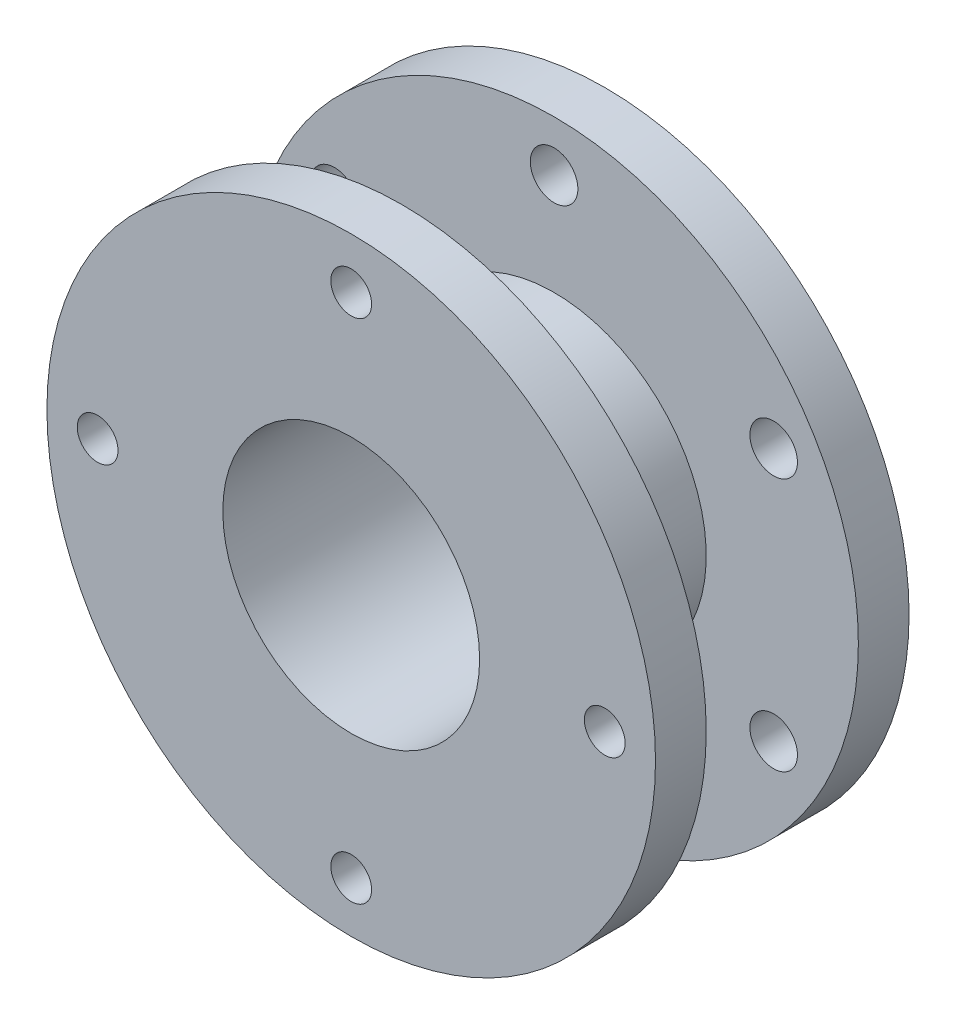
from build123d import *

# Parameters (mm, degrees)
SKETCH1_R                       = 38.1
BOSS_EXTRUDE1_DEPTH             = 6.35
SKETCH2_R                       = 19.05
BOSS_EXTRUDE2_DEPTH             = 19.05
SKETCH3_R                       = 16.0782
CUT_EXTRUDE1_DEPTH              = 60.56828015
CUT_EXTRUDE2_REACH              = 61.568
SKETCH4_R                       = 2.978668017
SKETCH5_R                       = 23.8633
SKETCH5_R_2                     = 21.7297
CUT_EXTRUDE3_DEPTH              = 1.3208
FILLET1_R                       = 0.127
FILLET2_R                       = 0.254
SKETCH6_R                       = 16.0782
CUT_EXTRUDE4_DEPTH              = 60.56828015
TAP_DRILL_FOR_1_4_20_TAP1_D     = 5.1054
TAP_DRILL_FOR_1_4_20_TAP1_DEPTH = 6.35


with BuildPart() as part:
    # Sketch1 → Boss-Extrude1 (new body)
    with BuildSketch(Plane.XY):
        Circle(SKETCH1_R)
    boss_extrude1 = extrude(amount=BOSS_EXTRUDE1_DEPTH)

    # Sketch2 → Boss-Extrude2 (add)
    with BuildSketch(Plane.XY.offset(6.35)):
        with Locations(Location((0, 0, 0), (0, 0, 180))):
            Circle(SKETCH2_R)
    extrude(amount=BOSS_EXTRUDE2_DEPTH)

    # Sketch3 → Cut-Extrude1 (cut, through all)
    with BuildSketch(Plane.XY.offset(25.4)):
        Circle(SKETCH3_R)
    extrude(amount=-CUT_EXTRUDE1_DEPTH, mode=Mode.SUBTRACT)

    # Sketch4 → Cut-Extrude2 (cut, up to next)
    with BuildSketch(Plane.XY, mode=Mode.PRIVATE) as cut_extrude2_sk1:
        with Locations(Location((0, 31.75, 0), (0, 0, 180))):
            Circle(SKETCH4_R)
    cut_extrude2_tool1 = extrude(cut_extrude2_sk1.sketch, amount=CUT_EXTRUDE2_REACH, mode=Mode.PRIVATE) & part.part
    # Sketch4 → Cut-Extrude2 (cut, up to next)
    with BuildSketch(Plane.XY, mode=Mode.PRIVATE) as cut_extrude2_sk2:
        with Locations(Location((27.49630657, 15.875, 0), (0, 0, 180))):
            Circle(SKETCH4_R)
    cut_extrude2_tool2 = extrude(cut_extrude2_sk2.sketch, amount=CUT_EXTRUDE2_REACH, mode=Mode.PRIVATE) & part.part
    # Sketch4 → Cut-Extrude2 (cut, up to next)
    with BuildSketch(Plane.XY, mode=Mode.PRIVATE) as cut_extrude2_sk3:
        with Locations(Location((27.49630657, -15.875, 0), (0, 0, 180))):
            Circle(SKETCH4_R)
    cut_extrude2_tool3 = extrude(cut_extrude2_sk3.sketch, amount=CUT_EXTRUDE2_REACH, mode=Mode.PRIVATE) & part.part
    # Sketch4 → Cut-Extrude2 (cut, up to next)
    with BuildSketch(Plane.XY, mode=Mode.PRIVATE) as cut_extrude2_sk4:
        with Locations(Location((0, -31.75, 0), (0, 0, 180))):
            Circle(SKETCH4_R)
    cut_extrude2_tool4 = extrude(cut_extrude2_sk4.sketch, amount=CUT_EXTRUDE2_REACH, mode=Mode.PRIVATE) & part.part
    # Sketch4 → Cut-Extrude2 (cut, up to next)
    with BuildSketch(Plane.XY, mode=Mode.PRIVATE) as cut_extrude2_sk5:
        with Locations(Location((-27.49630657, -15.875, 0), (0, 0, 180))):
            Circle(SKETCH4_R)
    cut_extrude2_tool5 = extrude(cut_extrude2_sk5.sketch, amount=CUT_EXTRUDE2_REACH, mode=Mode.PRIVATE) & part.part
    # Sketch4 → Cut-Extrude2 (cut, up to next)
    with BuildSketch(Plane.XY, mode=Mode.PRIVATE) as cut_extrude2_sk6:
        with Locations(Location((-27.49630657, 15.875, 0), (0, 0, 180))):
            Circle(SKETCH4_R)
    cut_extrude2_tool6 = extrude(cut_extrude2_sk6.sketch, amount=CUT_EXTRUDE2_REACH, mode=Mode.PRIVATE) & part.part
    add(cut_extrude2_tool1.solids().sort_by_distance((0, 31.75, 0))[0], mode=Mode.SUBTRACT)
    add(cut_extrude2_tool2.solids().sort_by_distance((27.496307, 15.875, 0))[0], mode=Mode.SUBTRACT)
    add(cut_extrude2_tool3.solids().sort_by_distance((27.496307, -15.875, 0))[0], mode=Mode.SUBTRACT)
    add(cut_extrude2_tool4.solids().sort_by_distance((0, -31.75, 0))[0], mode=Mode.SUBTRACT)
    add(cut_extrude2_tool5.solids().sort_by_distance((-27.496307, -15.875, 0))[0], mode=Mode.SUBTRACT)
    add(cut_extrude2_tool6.solids().sort_by_distance((-27.496307, 15.875, 0))[0], mode=Mode.SUBTRACT)

    # Sketch5 → Cut-Extrude3 (cut)
    with BuildSketch(Plane(origin=(0, 0, 0), x_dir=(-1, 0, 0), z_dir=(0, 0, -1))):
        Circle(SKETCH5_R)
        Circle(SKETCH5_R_2, mode=Mode.SUBTRACT)
    extrude(amount=-CUT_EXTRUDE3_DEPTH, mode=Mode.SUBTRACT)

    # Fillet1
    fillet1_edges = [part.edges().sort_by_distance(p)[0] for p in [
        (23.8633, 0, 0),
        (21.7297, 0, 0),
    ]]
    fillet(fillet1_edges, radius=FILLET1_R)

    # Fillet2
    fillet2_edges = [part.edges().sort_by_distance(p)[0] for p in [
        (23.8633, 0, 1.3208),
        (21.7297, 0, 1.3208),
    ]]
    fillet(fillet2_edges, radius=FILLET2_R)

    # Mirror1: Boss-Extrude1 across plane
    add(boss_extrude1.mirror(Plane.XY.offset(15.875)))

    # Sketch6 → Cut-Extrude4 (cut, through all)
    with BuildSketch(Plane(origin=(0, 0, 25.4), x_dir=(-1, 0, 0), z_dir=(0, 0, -1))):
        with Locations(Location((0, 0, 0), (0, 0, 180))):
            Circle(SKETCH6_R)
    extrude(amount=-CUT_EXTRUDE4_DEPTH, mode=Mode.SUBTRACT)

    # Tap Drill for 1/4-20 Tap1
    with Locations(Plane(origin=(0, 31.75, 31.75), x_dir=(1, 0, 0), z_dir=(0, 0, 1))):
        with Locations((0, 0), (31.75, -31.75), (0, -63.5), (-31.75, -31.75)):
            Hole(TAP_DRILL_FOR_1_4_20_TAP1_D / 2, depth=TAP_DRILL_FOR_1_4_20_TAP1_DEPTH)


solid = part.part
